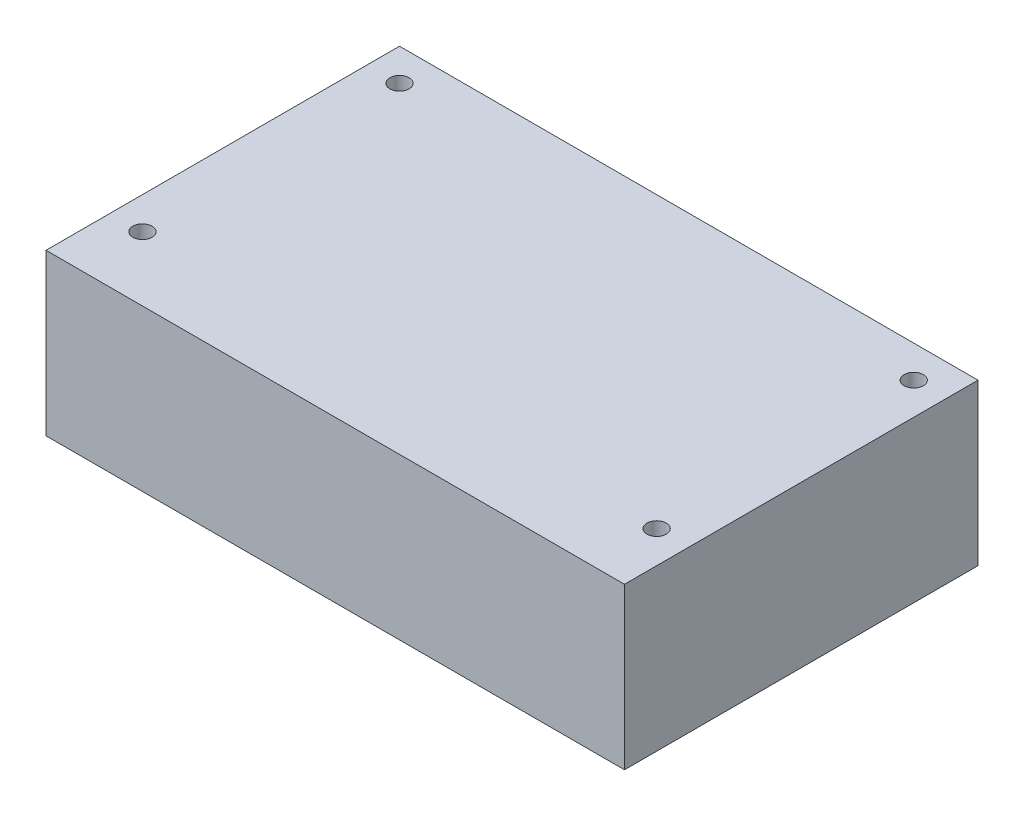
from build123d import *

# Parameters (mm, degrees)
SKETCH1_W           = 90
SKETCH1_H           = 55
SKETCH1_R           = 1.5
BOSS_EXTRUDE1_DEPTH = 25


with BuildPart() as part:
    # Sketch1 → Boss-Extrude1 (new body)
    with BuildSketch(Plane(origin=(0, 0, 0), x_dir=(1, 0, 0), z_dir=(0, 1, 0))):
        Rectangle(SKETCH1_W, SKETCH1_H)
        with Locations(Location((-40, 22.5, 0), (0, 0, 270))):
            Circle(SKETCH1_R, mode=Mode.SUBTRACT)
        with Locations(Location((40, 22.5, 0), (0, 0, 270))):
            Circle(SKETCH1_R, mode=Mode.SUBTRACT)
        with Locations(Location((40, -17.5, 0), (0, 0, 270))):
            Circle(SKETCH1_R, mode=Mode.SUBTRACT)
        with Locations(Location((-40, -17.5, 0), (0, 0, 270))):
            Circle(SKETCH1_R, mode=Mode.SUBTRACT)
    extrude(amount=BOSS_EXTRUDE1_DEPTH)


solid = part.part
